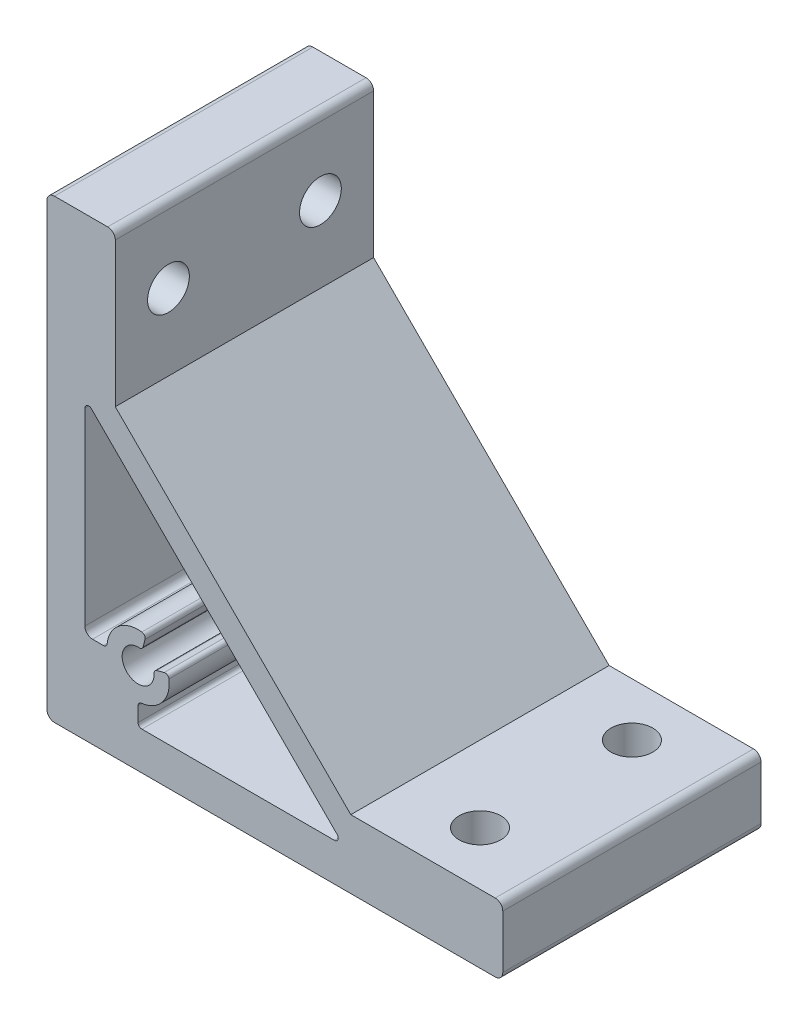
from build123d import *

# Parameters (mm, degrees)
EXTRUDE_14_DEPTH     = 34
SKETCH_41_R          = 2.75
CUT_EXTRUDE_27_DEPTH = 86.772956111
SKETCH_42_R          = 2.75
CUT_EXTRUDE_28_DEPTH = 86.772956111


with BuildPart() as part:
    # 草图40 → 凸台-拉伸14 (new body)
    with BuildSketch(Plane.XY):
        with BuildLine():
            Line((40, 9), (9, 40))
            Line((9, 40), (9, 59))
            ThreePointArc((9, 59), (8.707106781, 59.707106781), (8, 60))
            Line((8, 60), (1, 60))
            ThreePointArc((1, 60), (0.292893219, 59.707106781), (0, 59))
            Line((0, 59), (0, 1))
            ThreePointArc((0, 1), (0.292893219, 0.292893219), (1, 0))
            Line((1, 0), (59, 0))
            ThreePointArc((59, 0), (59.707106781, 0.292893219), (60, 1))
            Line((60, 1), (60, 8))
            ThreePointArc((60, 8), (59.707106781, 8.707106781), (59, 9))
            Line((59, 9), (40, 9))
        make_face()
        with BuildLine():
            Line((6, 12), (7.428034206, 12))
            ThreePointArc((7.428034206, 12), (7.761575809, 12.12750839), (7.925, 12.445000003))
            ThreePointArc((7.925, 12.445000003), (9.455281371, 15.213766145), (12.501000018, 16.068999998))
            ThreePointArc((12.501000018, 16.068999998), (12.854580587, 15.852403207), (12.923122843, 15.443459021))
            Line((12.923122843, 15.443459021), (12.661152875, 14.464571239))
            ThreePointArc((12.661152875, 14.464571239), (12.468861172, 14.18703128), (12.144000016, 14.094999999))
            ThreePointArc((12.144000016, 14.094999999), (10.51595825, 10.514958251), (14.095999999, 12.143000014))
            ThreePointArc((14.095999999, 12.143000014), (14.18803128, 12.467861171), (14.465571239, 12.660152875))
            Line((14.465571239, 12.660152875), (15.444578727, 12.922154879))
            ThreePointArc((15.444578727, 12.922154879), (15.853118545, 12.853885203), (16.07, 12.501))
            ThreePointArc((16.07, 12.501), (15.215158242, 9.454636451), (12.446000002, 7.924))
            ThreePointArc((12.446000002, 7.924), (12.127844119, 7.760840711), (12, 7.426924553))
            Line((12, 7.426924553), (12, 5.5))
            ThreePointArc((12, 5.5), (12.146446609, 5.146446609), (12.5, 5))
            Line((12.5, 5), (37.844, 5))
            ThreePointArc((37.844, 5), (38.305045436, 5.30916781), (38.196447939, 5.853552061))
            Line((38.196447939, 5.853552061), (5.853553317, 38.196446683))
            ThreePointArc((5.853553317, 38.196446683), (5.308658302, 38.304832993), (5, 37.842893363))
            Line((5, 37.842893363), (5, 13))
            ThreePointArc((5, 13), (5.292893219, 12.292893219), (6, 12))
        make_face(mode=Mode.SUBTRACT)
    extrude(amount=-EXTRUDE_14_DEPTH)

    # 草图41 → 切除-拉伸27 (cut, through all)
    with BuildSketch(Plane(origin=(0, 9, 0), x_dir=(1, 0, 0), z_dir=(0, 1, 0))):
        with Locations((50, 27)):
            Circle(SKETCH_41_R)
        with Locations((50, 7)):
            Circle(SKETCH_41_R)
    extrude(amount=-CUT_EXTRUDE_27_DEPTH, mode=Mode.SUBTRACT)

    # 草图42 → 切除-拉伸28 (cut, through all)
    with BuildSketch(Plane(origin=(9, 0, 0), x_dir=(0, 0, -1), z_dir=(1, 0, 0))):
        with Locations((7, 50)):
            Circle(SKETCH_42_R)
        with Locations((27, 50)):
            Circle(SKETCH_42_R)
    extrude(amount=-CUT_EXTRUDE_28_DEPTH, mode=Mode.SUBTRACT)


solid = part.part
